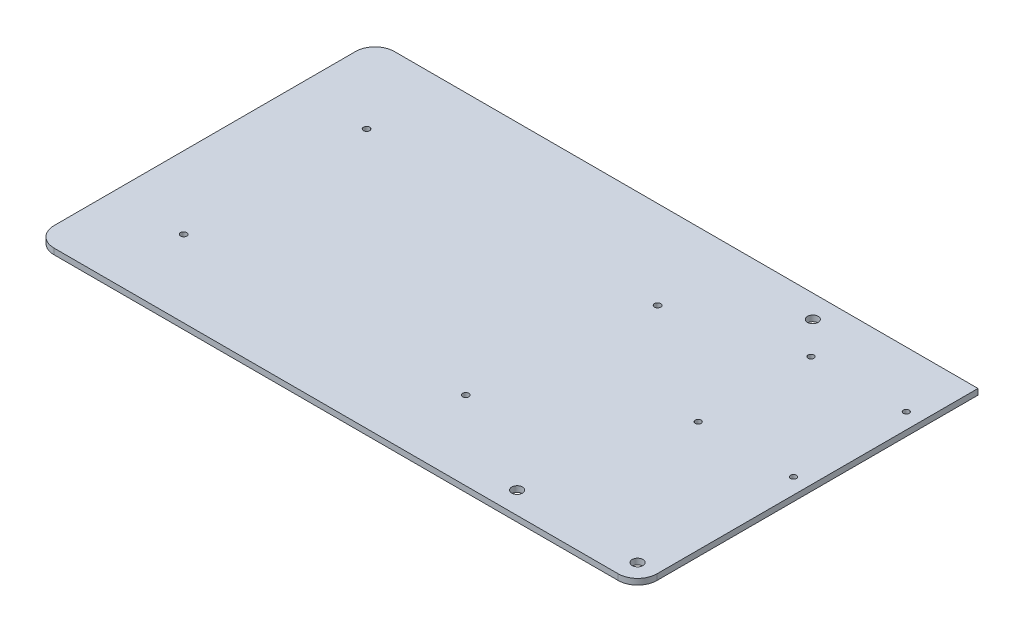
from build123d import *

# Parameters (mm, degrees)
ESQUISSE1_R        = 1.5
ESQUISSE1_R_2      = 2.75
BOSS_EXTRU_1_DEPTH = 3
SKETCH1_R          = 1.6
CUT_EXTRUDE9_DEPTH = 10


with BuildPart() as part:
    # Esquisse1 → Boss.-Extru.1 (new body)
    with BuildSketch(Plane(origin=(0, 0, 0), x_dir=(1, 0, 0), z_dir=(0, 1, 0))):
        with BuildLine():
            Line((-136.142857143, 92.5), (163.857142857, 92.5))
            Line((163.857142857, 92.5), (163.857142857, -72.5))
            ThreePointArc((163.857142857, -72.5), (160.928210669, -79.571067812), (153.857142857, -82.5))
            Line((153.857142857, -82.5), (-136.142857143, -82.5))
            ThreePointArc((-136.142857143, -82.5), (-143.213924955, -79.571067812), (-146.142857143, -72.5))
            Line((-146.142857143, -72.5), (-146.142857143, 82.5))
            ThreePointArc((-146.142857143, 82.5), (-143.213924955, 89.571067812), (-136.142857143, 92.5))
        make_face()
        with Locations(Location((106.778088173, 63.728751177, 0), (0, 0, 270))):
            Circle(ESQUISSE1_R, mode=Mode.SUBTRACT)
        with Locations(Location((155.778088173, 63.728751177, 0), (0, 0, 270))):
            Circle(ESQUISSE1_R, mode=Mode.SUBTRACT)
        with Locations(Location((106.778088173, 5.728751177, 0), (0, 0, 270))):
            Circle(ESQUISSE1_R, mode=Mode.SUBTRACT)
        with Locations(Location((90.64338627, 80.8, 0), (0, 0, 270))):
            Circle(ESQUISSE1_R_2, mode=Mode.SUBTRACT)
        with Locations(Location((155.778088173, 5.728751177, 0), (0, 0, 270))):
            Circle(ESQUISSE1_R, mode=Mode.SUBTRACT)
        with Locations(Location((153.857142857, -72.5, 0), (0, 0, 270))):
            Circle(ESQUISSE1_R_2, mode=Mode.SUBTRACT)
        with Locations(Location((90.643386268, -71.199999991, 0), (0, 0, 270))):
            Circle(ESQUISSE1_R_2, mode=Mode.SUBTRACT)
    extrude(amount=BOSS_EXTRU_1_DEPTH)

    # Sketch1 → Cut-Extrude9 (cut)
    with BuildSketch(Plane(origin=(0, 3, 0), x_dir=(1, 0, 0), z_dir=(0, 1, 0))):
        with Locations(Location((44.5256506, 47.141960397, 0), (0, 0, 270))):
            Circle(SKETCH1_R)
        with Locations(Location((35.132799329, -42.123541034, 0), (0, 0, 270))):
            Circle(SKETCH1_R)
        with Locations(Location((-108.930202511, -43.053575675, 0), (0, 0, 270))):
            Circle(SKETCH1_R)
        with Locations(Location((-108.84020251, 50.896424322, 0), (0, 0, 270))):
            Circle(SKETCH1_R)
    extrude(amount=-CUT_EXTRUDE9_DEPTH, mode=Mode.SUBTRACT)


solid = part.part
